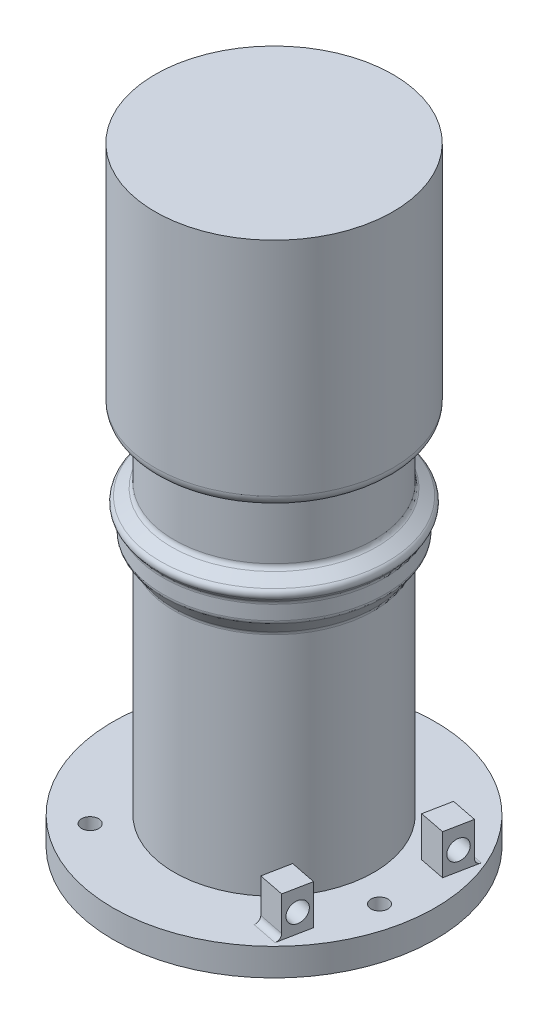
from build123d import *

# Parameters (mm, degrees)
SKETCH3_R           = 71.755
BOSS_EXTRUDE1_DEPTH = 12.192
SKETCH5_R           = 3.81
CUT_EXTRUDE1_DEPTH  = 12.192
BOSS_EXTRUDE2_DEPTH = 17.78
SKETCH7_R           = 4.445
CUT_EXTRUDE2_DEPTH  = 11.825629063
FILLET1_R           = 2.54
FILLET2_R           = 2.54
FILLET3_R           = 2.54
FILLET4_R           = 5.08
SKETCH8_R           = 37.861238203
CUT_EXTRUDE3_DEPTH  = 25.4


with BuildPart() as part:
    # Sketch2 → Revolve1 (revolve)
    with BuildSketch(Plane.XY, mode=Mode.PRIVATE) as revolve1_sk:
        Polygon((44.45, 101.6), (49.454248958, 108.957028549), (49.454248958, 116.953034196), (52.952501428, 121.450787373), (44.45, 126.781457804), (44.45, 152.181457804), (52.952501428, 157.345544784), (52.952501428, 258.945544784), (0, 258.945544784), (0, 0), (44.45, 0), align=None)
    revolve(revolve1_sk.sketch.rotate(Axis((0, 0, 0), (0, 1, 0)), 90), axis=Axis((0, 0, 0), (0, 1, 0)))

    # Sketch3 → Boss-Extrude1 (add)
    with BuildSketch(Plane(origin=(0, 0, 0), x_dir=(-1, 0, 0), z_dir=(0, -1, 0))):
        with Locations(Location((0, 0, 0), (0, 0, 270))):
            Circle(SKETCH3_R)
    extrude(amount=BOSS_EXTRUDE1_DEPTH)

    # Sketch5 → Cut-Extrude1 (cut)
    with BuildSketch(Plane(origin=(0, -12.192, 0), x_dir=(-1, 0, 0), z_dir=(0, -1, 0))):
        with Locations(Location((37.525239886, -44.355653959, 0), (0, 0, 90))):
            Circle(SKETCH5_R)
        with Locations(Location((-57.878931107, -10.924581268, 0), (0, 0, 90))):
            Circle(SKETCH5_R)
        with Locations(Location((18.775312616, 54.982318092, 0), (0, 0, 90))):
            Circle(SKETCH5_R)
    extrude(amount=-CUT_EXTRUDE1_DEPTH, mode=Mode.SUBTRACT)

    # Sketch6 → Boss-Extrude2 (add)
    with BuildSketch(Plane(origin=(0, 0, 0), x_dir=(1, 0, 0), z_dir=(0, 1, 0))):
        Polygon((50.216487636, 15.501795378), (61.817471266, 13.207741855), (64.16167292, 25.062323602), (52.560689291, 27.356377124), align=None)
        Polygon((38.390858573, -44.300178647), (49.991842203, -46.59423217), (52.336043857, -34.739650423), (40.735060228, -32.445596901), align=None)
    extrude(amount=BOSS_EXTRUDE2_DEPTH)

    # Sketch7 → Cut-Extrude2 (cut)
    with BuildSketch(Plane(origin=(56.977651962, 0, 11.267129355), x_dir=(0.193989978070432, 0, -0.9810035109051514), z_dir=(0.9810035109051514, 0, 0.193989978070432))):
        with Locations((-29.969120003, 8.382)):
            Circle(SKETCH7_R)
    cut_extrude2 = extrude(amount=-CUT_EXTRUDE2_DEPTH, mode=Mode.SUBTRACT)

    # Fillet1
    fillet1_edges = [part.edges().sort_by_distance(p)[0] for p in [
        (44.191350388, 0, 45.447205408),
    ]]
    fillet(fillet1_edges, radius=FILLET1_R)

    # Mirror1: Cut-Extrude2 across plane
    add(cut_extrude2.mirror(Plane(origin=(0.099105599, 0, -0.50117507), x_dir=(0.9810035109051514, 0, 0.19398997807043172), z_dir=(-0.19398997807043172, 0, 0.9810035109051514))), mode=Mode.SUBTRACT)

    # Fillet2
    fillet2_edges = [part.edges().sort_by_distance(p)[0] for p in [
        (58.361181106, 0, -26.209350363),
    ]]
    fillet(fillet2_edges, radius=FILLET2_R)

    # Fillet3
    fillet3_edges = [part.edges().sort_by_distance(p)[0] for p in [
        (0, 116.953034196, 49.454248958),
        (0, 108.957028549, 49.454248958),
        (0, 101.6, 44.45),
        (0, 126.781457804, 44.45),
        (0, 121.450787373, 52.952501428),
    ]]
    fillet(fillet3_edges, radius=FILLET3_R)

    # Fillet4
    fillet4_edges = [part.edges().sort_by_distance(p)[0] for p in [
        (0, 157.345544784, 52.952501428),
    ]]
    fillet(fillet4_edges, radius=FILLET4_R)

    # Sketch8 → Cut-Extrude3 (cut)
    with BuildSketch(Plane(origin=(0, -12.192, 0), x_dir=(-1, 0, 0), z_dir=(0, -1, 0))):
        with Locations(Location((0, 0, 0), (0, 0, 90))):
            Circle(SKETCH8_R)
    extrude(amount=-CUT_EXTRUDE3_DEPTH, mode=Mode.SUBTRACT)


solid = part.part
